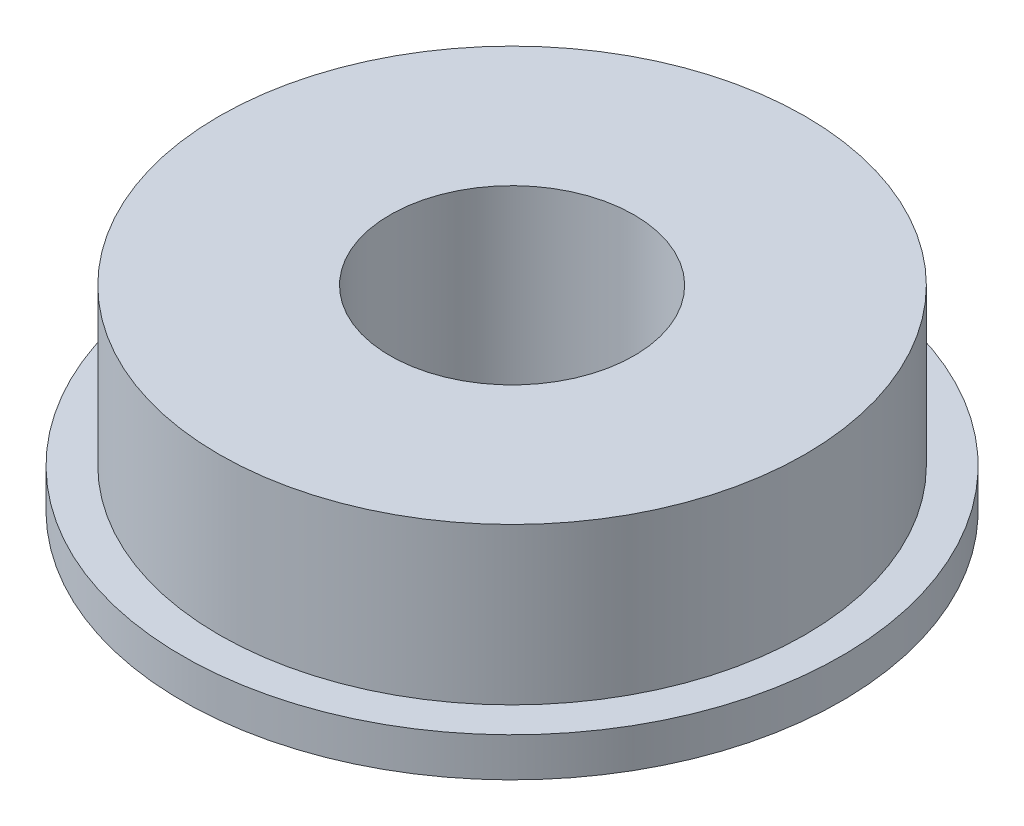
from build123d import *


with BuildPart() as part:
    # Sketch1 → Revolve1 (revolve)
    with BuildSketch(Plane.XY, mode=Mode.PRIVATE) as revolve1_sk:
        Polygon((2.5, 0), (2.5, 4), (6, 4), (6, 0.8), (6.75, 0.8), (6.75, 0), align=None)
    revolve(revolve1_sk.sketch.rotate(Axis((0, 0, 0), (0, 1, 0)), 90), axis=Axis((0, 0, 0), (0, 1, 0)))


solid = part.part
